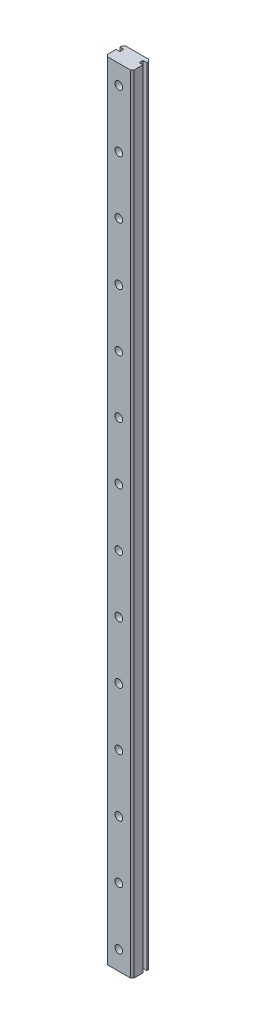
from build123d import *

# Parameters (mm, degrees)
EXTRUDE_1_DEPTH     = 205
SKETCH_2_R          = 1
CUT_EXTRUDE_1_DEPTH = 10
CHAMFER_1_SIZE      = 0.5
SKETCH_3_R          = 2.383304988
CUT_EXTRUDE_2_DEPTH = 1


with BuildPart() as part:
    # 草图1 → 凸台-拉伸1 (new body)
    with BuildSketch(Plane(origin=(0, 0, 0), x_dir=(1, 0, 0), z_dir=(0, 1, 0))):
        Polygon((-3.5, 0.4), (-3.5, -2.4), (3.5, -2.4), (3.5, 0.4), (2.5, 0.4), (2.5, 1.4), (3.5, 1.4), (3.5, 2.4), (-3.5, 2.4), (-3.5, 1.4), (-2.5, 1.4), (-2.5, 0.4), align=None)
    extrude(amount=EXTRUDE_1_DEPTH)

    # 草图2 → 切除-拉伸1 (cut)
    with BuildSketch(Plane(origin=(0, 0, -2.4), x_dir=(-1, 0, 0), z_dir=(0, 0, -1))):
        with Locations((0, 5)):
            Circle(SKETCH_2_R)
        with Locations((0, 20)):
            Circle(SKETCH_2_R)
        with Locations((0, 35)):
            Circle(SKETCH_2_R)
        with Locations((0, 50)):
            Circle(SKETCH_2_R)
        with Locations((0, 65)):
            Circle(SKETCH_2_R)
        with Locations((0, 80)):
            Circle(SKETCH_2_R)
        with Locations((0, 95)):
            Circle(SKETCH_2_R)
        with Locations((0, 110)):
            Circle(SKETCH_2_R)
        with Locations((0, 125)):
            Circle(SKETCH_2_R)
        with Locations((0, 140)):
            Circle(SKETCH_2_R)
        with Locations((0, 155)):
            Circle(SKETCH_2_R)
        with Locations((0, 170)):
            Circle(SKETCH_2_R)
        with Locations((0, 185)):
            Circle(SKETCH_2_R)
        with Locations((0, 200)):
            Circle(SKETCH_2_R)
    extrude(amount=-CUT_EXTRUDE_1_DEPTH, mode=Mode.SUBTRACT)

    # 倒角1
    chamfer_1_edges = [part.edges().sort_by_distance(p)[0] for p in [
        (-3.5, 102.5, -2.4),
        (3.5, 102.5, -2.4),
        (3.5, 102.5, 2.4),
        (-3.5, 102.5, 2.4),
    ]]
    chamfer(chamfer_1_edges, length=CHAMFER_1_SIZE)

    # 草图3 → 切除-拉伸2 (cut)
    with BuildSketch(Plane(origin=(0, 0, -2.4), x_dir=(-1, 0, 0), z_dir=(0, 0, -1))):
        with Locations((0, 5)):
            Circle(SKETCH_3_R)
        with Locations((0, 20)):
            Circle(SKETCH_3_R)
        with Locations((0, 35)):
            Circle(SKETCH_3_R)
        with Locations((0, 50)):
            Circle(SKETCH_3_R)
        with Locations((0, 65)):
            Circle(SKETCH_3_R)
        with Locations((0, 80)):
            Circle(SKETCH_3_R)
        with Locations((0, 95)):
            Circle(SKETCH_3_R)
        with Locations((0, 110)):
            Circle(SKETCH_3_R)
        with Locations((0, 125)):
            Circle(SKETCH_3_R)
        with Locations((0, 140)):
            Circle(SKETCH_3_R)
        with Locations((0, 155)):
            Circle(SKETCH_3_R)
        with Locations((0, 170)):
            Circle(SKETCH_3_R)
        with Locations((0, 185)):
            Circle(SKETCH_3_R)
        with Locations((0, 200)):
            Circle(SKETCH_3_R)
    extrude(amount=-CUT_EXTRUDE_2_DEPTH, mode=Mode.SUBTRACT)


solid = part.part
